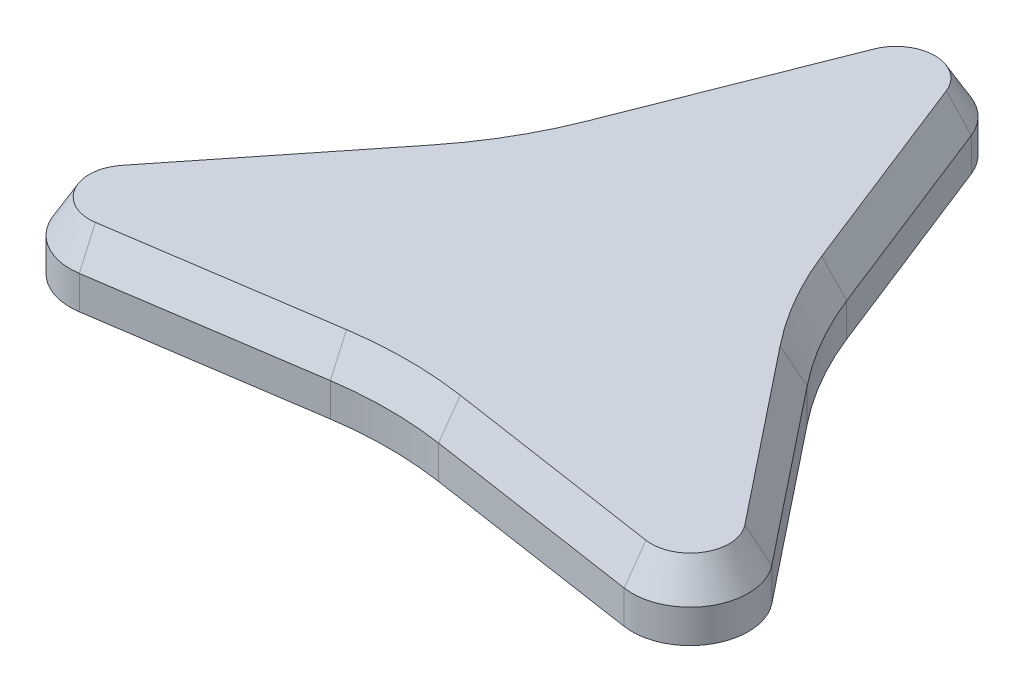
from build123d import *
from OCP.BRepFilletAPI import BRepFilletAPI_MakeChamfer

# Parameters (mm, degrees)
EXTRUDE2_DEPTH     = 8
CHAMFER2_SIZE      = 4
CHAMFER2_SIZE2     = 2.309401077
CUT_EXTRUDE1_DEPTH = 3


with BuildPart() as part:
    # Sketch1 → Extrude2 (new body)
    with BuildSketch(Plane(origin=(0, 0, 0), x_dir=(1, 0, 0), z_dir=(0, 1, 0))):
        with BuildLine():
            Line((-6.5, 41.572883869), (-16.221725084, 16.871170844))
            ThreePointArc((-16.221725084, 16.871170844), (-17.527996386, 13.882959965), (-19.052558883, 11))
            ThreePointArc((-19.052558883, 11), (-20.786994202, 8.238210165), (-22.721725084, 5.612840594))
            Line((-22.721725084, 5.612840594), (-39.253173539, -15.15727681))
            ThreePointArc((-39.253173539, -15.15727681), (-39.837168574, -23), (-32.753173539, -26.415607059))
            Line((-32.753173539, -26.415607059), (-6.5, -22.484011438))
            ThreePointArc((-6.5, -22.484011438), (-3.258997817, -22.12117013), (0, -22))
            ThreePointArc((0, -22), (3.258997817, -22.12117013), (6.5, -22.484011438))
            Line((6.5, -22.484011438), (32.753173539, -26.415607059))
            ThreePointArc((32.753173539, -26.415607059), (39.837168574, -23), (39.253173539, -15.15727681))
            Line((39.253173539, -15.15727681), (22.721725084, 5.612840594))
            ThreePointArc((22.721725084, 5.612840594), (20.786994202, 8.238210165), (19.052558883, 11))
            ThreePointArc((19.052558883, 11), (17.527996386, 13.882959965), (16.221725084, 16.871170844))
            Line((16.221725084, 16.871170844), (6.5, 41.572883869))
            ThreePointArc((6.5, 41.572883869), (0, 46), (-6.5, 41.572883869))
        make_face()
    extrude(amount=EXTRUDE2_DEPTH)

    # Chamfer2: one chamfer whose edges measure the first distance from different faces: ONE call of the kernel's chamfer builder (chamfer() names one face for all edges)
    chamfer2_edges_1 = [part.edges().sort_by_distance(p)[0] for p in [
        (-19.052558883, 8, -11),
    ]]
    chamfer2_side_1 = [part.faces().sort_by_distance(p)[0] for p in [
        (-19.052558883, 4, -11),
    ]]
    chamfer2_edges_2 = [part.edges().sort_by_distance(p)[0] for p in [
        (-30.987449312, 8, 4.772218108),
    ]]
    chamfer2_side_2 = [part.faces().sort_by_distance(p)[0] for p in [
        (-30.987449312, 4, 4.772218108),
    ]]
    chamfer2_edges_3 = [part.edges().sort_by_distance(p)[0] for p in [
        (-39.837168574, 8, 23),
    ]]
    chamfer2_side_3 = [part.faces().sort_by_distance(p)[0] for p in [
        (-39.837168574, 4, 23),
    ]]
    chamfer2_edges_4 = [part.edges().sort_by_distance(p)[0] for p in [
        (-19.626586769, 8, 24.449809248),
    ]]
    chamfer2_side_4 = [part.faces().sort_by_distance(p)[0] for p in [
        (-19.626586769, 4, 24.449809248),
    ]]
    chamfer2_edges_5 = [part.edges().sort_by_distance(p)[0] for p in [
        (0, 8, 22),
    ]]
    chamfer2_side_5 = [part.faces().sort_by_distance(p)[0] for p in [
        (0, 4, 22),
    ]]
    chamfer2_edges_6 = [part.edges().sort_by_distance(p)[0] for p in [
        (19.626586769, 8, 24.449809248),
    ]]
    chamfer2_side_6 = [part.faces().sort_by_distance(p)[0] for p in [
        (19.626586769, 4, 24.449809248),
    ]]
    chamfer2_edges_7 = [part.edges().sort_by_distance(p)[0] for p in [
        (39.837168574, 8, 23),
    ]]
    chamfer2_side_7 = [part.faces().sort_by_distance(p)[0] for p in [
        (39.837168574, 4, 23),
    ]]
    chamfer2_edges_8 = [part.edges().sort_by_distance(p)[0] for p in [
        (30.987449312, 8, 4.772218108),
    ]]
    chamfer2_side_8 = [part.faces().sort_by_distance(p)[0] for p in [
        (30.987449312, 4, 4.772218108),
    ]]
    chamfer2_edges_9 = [part.edges().sort_by_distance(p)[0] for p in [
        (0, 8, -46),
    ]]
    chamfer2_side_9 = [part.faces().sort_by_distance(p)[0] for p in [
        (0, 4, -46),
    ]]
    chamfer2_edges_10 = [part.edges().sort_by_distance(p)[0] for p in [
        (19.052558883, 8, -11),
    ]]
    chamfer2_side_10 = [part.faces().sort_by_distance(p)[0] for p in [
        (19.052558883, 4, -11),
    ]]
    chamfer2_edges_11 = [part.edges().sort_by_distance(p)[0] for p in [
        (11.360862542, 8, -29.222027356),
    ]]
    chamfer2_side_11 = [part.faces().sort_by_distance(p)[0] for p in [
        (11.360862542, 4, -29.222027356),
    ]]
    chamfer2_edges_12 = [part.edges().sort_by_distance(p)[0] for p in [
        (-11.360862542, 8, -29.222027356),
    ]]
    chamfer2_side_12 = [part.faces().sort_by_distance(p)[0] for p in [
        (-11.360862542, 4, -29.222027356),
    ]]
    chamfer2 = BRepFilletAPI_MakeChamfer(part.part.solid().wrapped)
    for e in chamfer2_edges_1:
        chamfer2.Add(CHAMFER2_SIZE, CHAMFER2_SIZE2, e.wrapped, chamfer2_side_1[0].wrapped)  # the first distance lies on this face
    for e in chamfer2_edges_2:
        chamfer2.Add(CHAMFER2_SIZE, CHAMFER2_SIZE2, e.wrapped, chamfer2_side_2[0].wrapped)  # the first distance lies on this face
    for e in chamfer2_edges_3:
        chamfer2.Add(CHAMFER2_SIZE, CHAMFER2_SIZE2, e.wrapped, chamfer2_side_3[0].wrapped)  # the first distance lies on this face
    for e in chamfer2_edges_4:
        chamfer2.Add(CHAMFER2_SIZE, CHAMFER2_SIZE2, e.wrapped, chamfer2_side_4[0].wrapped)  # the first distance lies on this face
    for e in chamfer2_edges_5:
        chamfer2.Add(CHAMFER2_SIZE, CHAMFER2_SIZE2, e.wrapped, chamfer2_side_5[0].wrapped)  # the first distance lies on this face
    for e in chamfer2_edges_6:
        chamfer2.Add(CHAMFER2_SIZE, CHAMFER2_SIZE2, e.wrapped, chamfer2_side_6[0].wrapped)  # the first distance lies on this face
    for e in chamfer2_edges_7:
        chamfer2.Add(CHAMFER2_SIZE, CHAMFER2_SIZE2, e.wrapped, chamfer2_side_7[0].wrapped)  # the first distance lies on this face
    for e in chamfer2_edges_8:
        chamfer2.Add(CHAMFER2_SIZE, CHAMFER2_SIZE2, e.wrapped, chamfer2_side_8[0].wrapped)  # the first distance lies on this face
    for e in chamfer2_edges_9:
        chamfer2.Add(CHAMFER2_SIZE, CHAMFER2_SIZE2, e.wrapped, chamfer2_side_9[0].wrapped)  # the first distance lies on this face
    for e in chamfer2_edges_10:
        chamfer2.Add(CHAMFER2_SIZE, CHAMFER2_SIZE2, e.wrapped, chamfer2_side_10[0].wrapped)  # the first distance lies on this face
    for e in chamfer2_edges_11:
        chamfer2.Add(CHAMFER2_SIZE, CHAMFER2_SIZE2, e.wrapped, chamfer2_side_11[0].wrapped)  # the first distance lies on this face
    for e in chamfer2_edges_12:
        chamfer2.Add(CHAMFER2_SIZE, CHAMFER2_SIZE2, e.wrapped, chamfer2_side_12[0].wrapped)  # the first distance lies on this face
    add(Compound.cast(chamfer2.Shape()), mode=Mode.REPLACE)

    # Sketch2 → Cut-Extrude1 (cut)
    with BuildSketch(Plane(origin=(0, 0, 0), x_dir=(1, 0, 0), z_dir=(0, 1, 0))):
        with BuildLine():
            ThreePointArc((-33.135101254, -24.464580596), (-38.117859233, -22.00735629), (-37.754498914, -16.463549149))
            ThreePointArc((-37.754498914, -16.463549149), (-36.352384156, -16.278957239), (-36.167792243, -17.681071999))
            ThreePointArc((-36.167792243, -17.681071999), (-36.385808436, -21.007356296), (-33.396153637, -22.481690885))
            ThreePointArc((-33.396153637, -22.481690885), (-32.274182592, -23.342609551), (-33.135101254, -24.464580596))
        make_face()
        with BuildLine():
            ThreePointArc((-4.619397662, 40.928129741), (-1e-09, 44.014712579), (4.619397658, 40.928129741))
            ThreePointArc((4.619397658, 40.928129741), (4.078201562, 39.621566787), (2.771638604, 40.162762881))
            ThreePointArc((2.771638604, 40.162762881), (-1e-09, 42.014712591), (-2.771638608, 40.162762881))
            ThreePointArc((-2.771638608, 40.162762881), (-4.078201566, 39.621566787), (-4.619397662, 40.928129741))
        make_face()
        with BuildLine():
            ThreePointArc((37.754498916, -16.463549145), (38.117859234, -22.007356289), (33.135101256, -24.464580593))
            ThreePointArc((33.135101256, -24.464580593), (32.274182594, -23.342609548), (33.396153639, -22.481690882))
            ThreePointArc((33.396153639, -22.481690882), (36.385808436, -21.007356295), (36.167792245, -17.681071996))
            ThreePointArc((36.167792245, -17.681071996), (36.352384158, -16.278957236), (37.754498916, -16.463549145))
        make_face()
    extrude(amount=CUT_EXTRUDE1_DEPTH, mode=Mode.SUBTRACT)


solid = part.part
